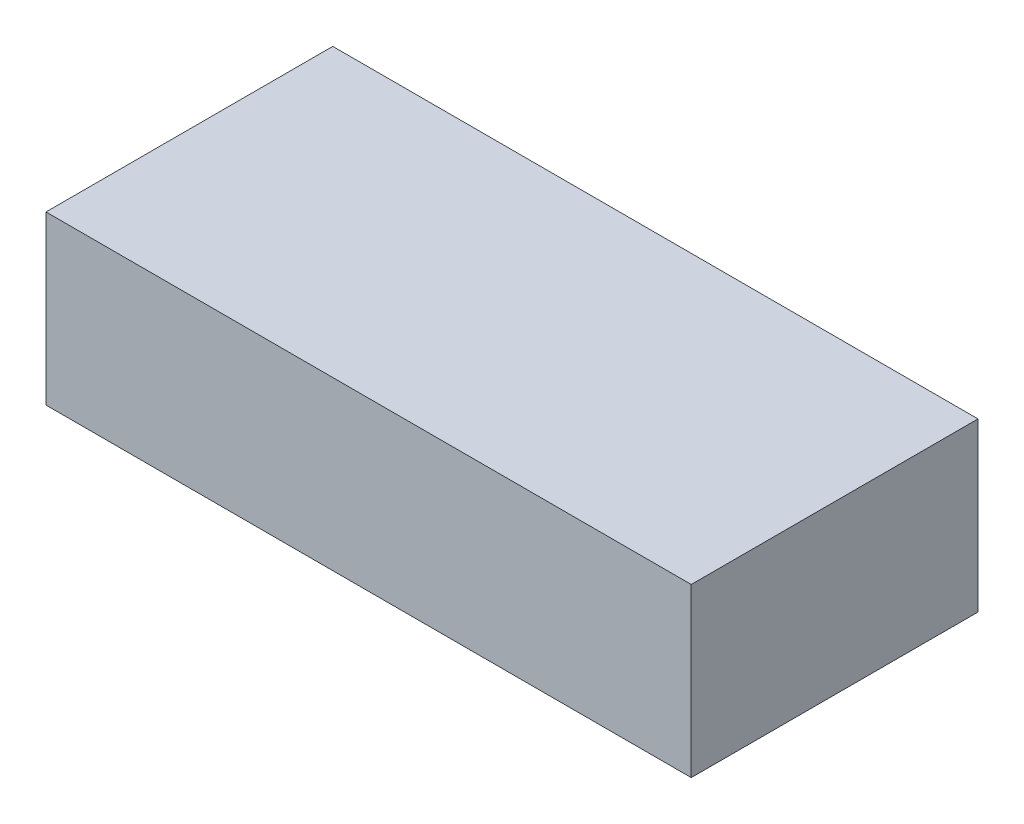
from build123d import *

# Parameters (mm, degrees)
SKETCH1_W           = 270
SKETCH1_H           = 120
BOSS_EXTRUDE1_DEPTH = 70


with BuildPart() as part:
    # Sketch1 → Boss-Extrude1 (new body)
    with BuildSketch(Plane(origin=(0, 0, 0), x_dir=(1, 0, 0), z_dir=(0, 1, 0))):
        with Locations((45.040467626, 27.706834532)):
            Rectangle(SKETCH1_W, SKETCH1_H)
    extrude(amount=BOSS_EXTRUDE1_DEPTH)


solid = part.part
